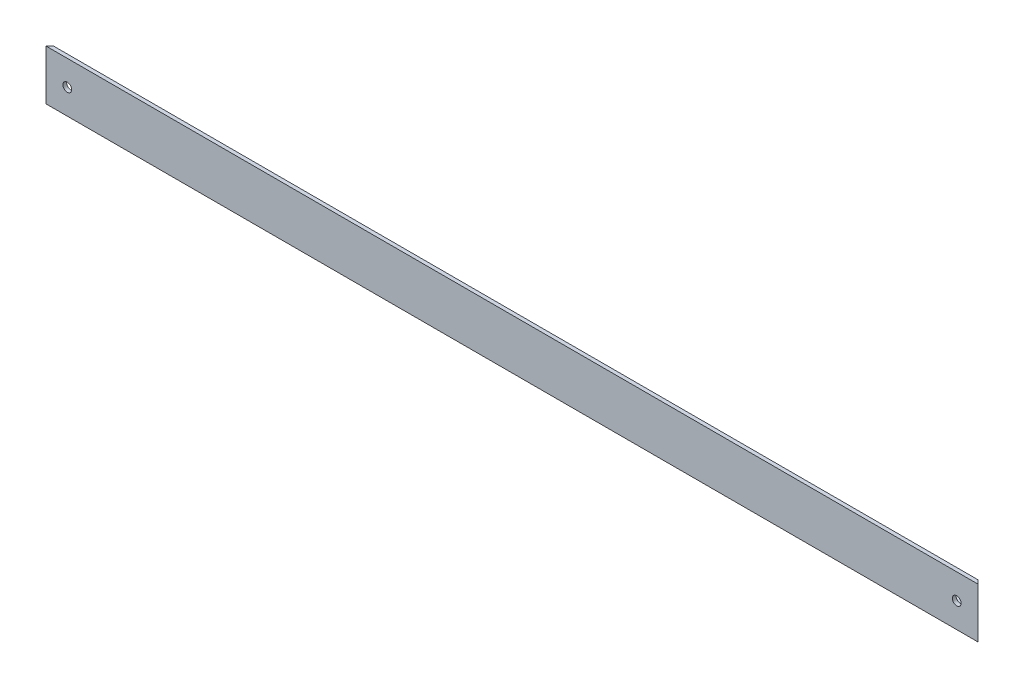
from build123d import *

# Parameters (mm, degrees)
EXTRUDE_1_DEPTH     = 372
CUT_EXTRUDE_1_DEPTH = 374.073719257
CUT_EXTRUDE_2_REACH = 375.074
SKETCH_3_R          = 1.75


with BuildPart() as part:
    # Эскиз1 → Бобышка-Вытянуть1 (new body)
    with BuildSketch(Plane(origin=(0, 0, 0), x_dir=(0, 0, -1), z_dir=(1, 0, 0))):
        Polygon((0, 0), (20, 0), (20, 1.5), (1.5, 1.5), (1.5, 20), (0, 20), align=None)
    extrude(amount=EXTRUDE_1_DEPTH)

    # Эскиз2 → Вырез-Вытянуть1 (cut, through all)
    with BuildSketch(Plane.XZ):
        Polygon((0, 0), (0, -20), (20, -20), align=None)
    cut_extrude_1 = extrude(amount=-CUT_EXTRUDE_1_DEPTH, mode=Mode.SUBTRACT)

    # Эскиз3 → Вырез-Вытянуть2 (cut, up to next)
    with BuildSketch(Plane.XY, mode=Mode.PRIVATE) as cut_extrude_2_sk1:
        with Locations((8.5, 10)):
            Circle(SKETCH_3_R)
    cut_extrude_2_tool1 = extrude(cut_extrude_2_sk1.sketch, amount=-CUT_EXTRUDE_2_REACH, mode=Mode.PRIVATE) & part.part
    cut_extrude_2 = cut_extrude_2_tool1.solids().sort_by_distance((8.5, 10, 0))[0]
    add(cut_extrude_2, mode=Mode.SUBTRACT)

    # Зеркальное отражение3: Вырез-Вытянуть1, Вырез-Вытянуть2 across plane
    add(cut_extrude_1.mirror(Plane(origin=(186, 0, 0), x_dir=(0, 0, 1), z_dir=(1, 0, 0))), mode=Mode.SUBTRACT)
    add(cut_extrude_2.mirror(Plane(origin=(186, 0, 0), x_dir=(0, 0, 1), z_dir=(1, 0, 0))), mode=Mode.SUBTRACT)


solid = part.part
